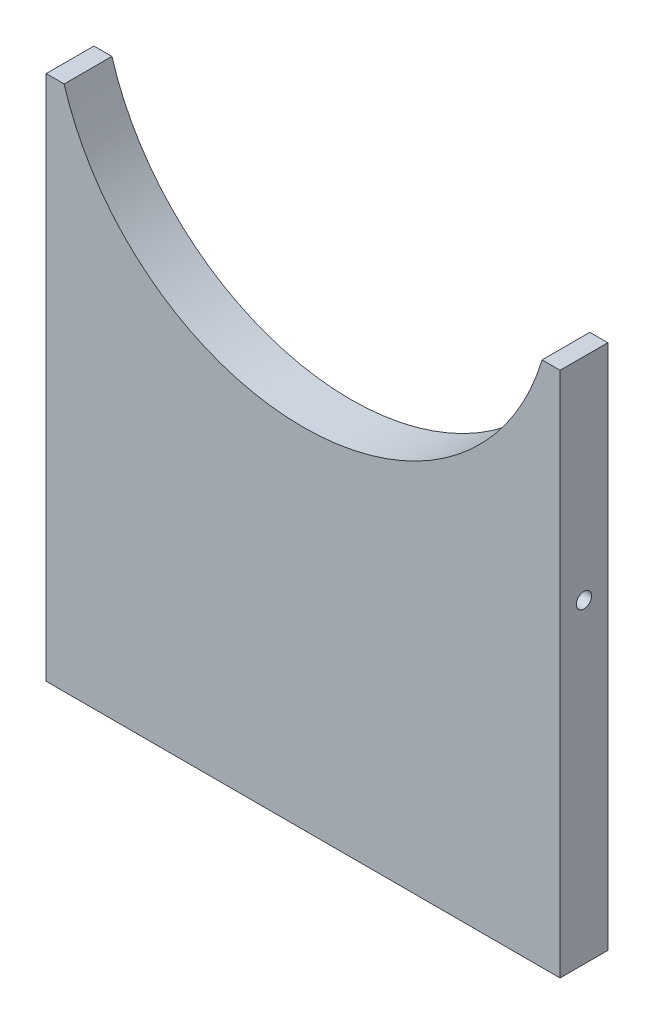
from build123d import *

# Parameters (mm, degrees)
BOSS_EXTRUDE1_DEPTH        = 12.7
F_10_32_TAPPED_HOLE2_D     = 4.0386
F_10_32_TAPPED_HOLE2_DEPTH = 25.4
F_10_32_TAPPED_HOLE2_TIP   = 1.213317848


with BuildPart() as part:
    # Sketch1 → Boss-Extrude1 (new body)
    with BuildSketch(Plane.XY):
        with BuildLine():
            Line((0, 0), (0, 140))
            Line((0, 140), (4.78641843, 140))
            ThreePointArc((4.78641843, 140), (68.35, 92.725758639), (131.91358157, 140))
            Line((131.91358157, 140), (136.7, 140))
            Line((136.7, 140), (136.7, 0))
            Line((136.7, 0), (0, 0))
        make_face()
    extrude(amount=BOSS_EXTRUDE1_DEPTH)

    # Sketch3 → #10-32 Tapped Hole1 (revolve, cut)
    with BuildSketch(Plane(origin=(136.7, 83.866, 6.35), x_dir=(0, 0, -1), z_dir=(0, 1, 0))):
        Polygon((0, 0), (0, 26.613317848), (2.0193, 25.4), (2.0193, 0), align=None)
    f_10_32_tapped_hole1 = revolve(axis=Axis((143.05, 83.866, 6.35), (-1, 0, 0)), mode=Mode.SUBTRACT)

    # Mirror3: #10-32 Tapped Hole1 across plane
    add(f_10_32_tapped_hole1.mirror(Plane(origin=(68.35, 0, 0), x_dir=(0, 0, 1), z_dir=(1, 0, 0))), mode=Mode.SUBTRACT)

    # #10-32 Tapped Hole2
    with Locations(Plane(origin=(112.35, 0, 6.35), x_dir=(0, 0, -1), z_dir=(0, -1, 0))):
        with Locations((0, 0), (0, -88)):
            Hole(F_10_32_TAPPED_HOLE2_D / 2, depth=F_10_32_TAPPED_HOLE2_DEPTH)
            with Locations((0, 0, -(F_10_32_TAPPED_HOLE2_DEPTH + F_10_32_TAPPED_HOLE2_TIP / 2))):  # 118° drill point
                Cone(0, F_10_32_TAPPED_HOLE2_D / 2, F_10_32_TAPPED_HOLE2_TIP, mode=Mode.SUBTRACT)


solid = part.part
